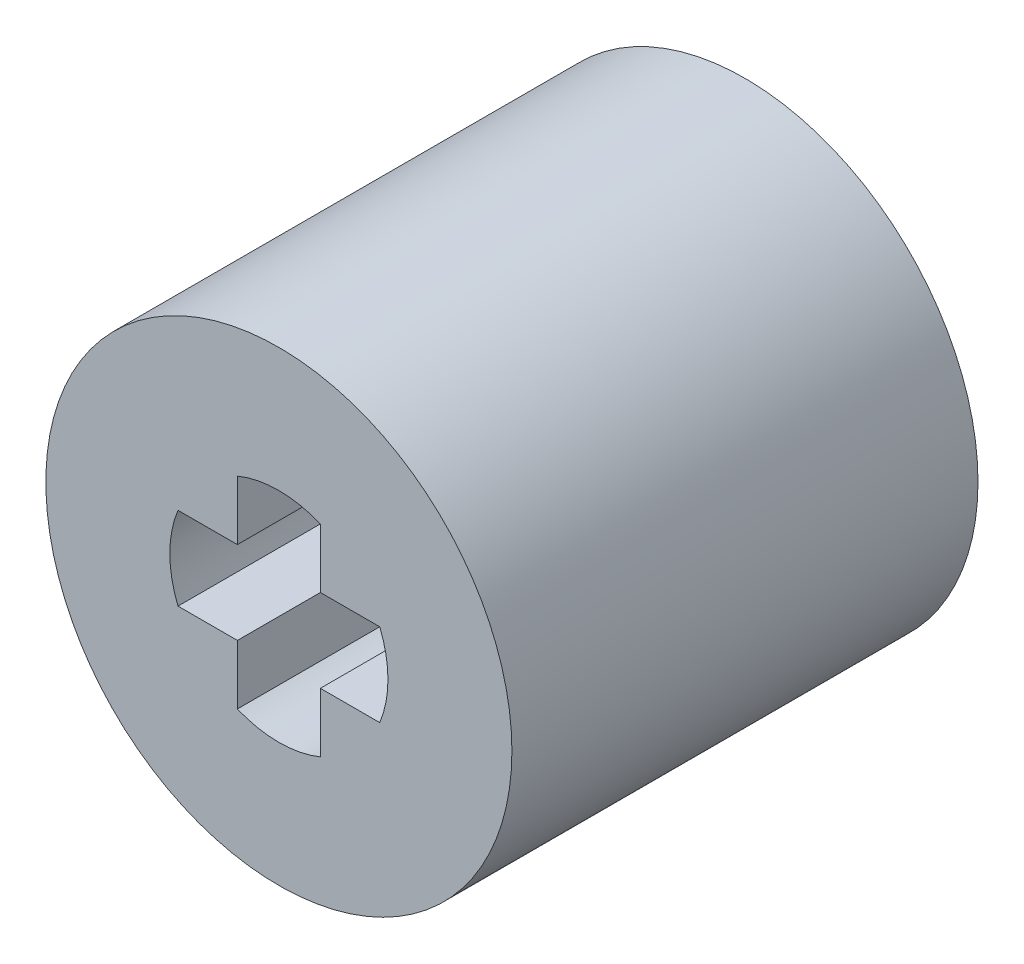
from build123d import *

# Parameters (mm, degrees)
SKETCH1_R           = 5
BOSS_EXTRUDE1_DEPTH = 5
BOSS_EXTRUDE2_START = -5
SKETCH1_3_R         = 5
BOSS_EXTRUDE2_DEPTH = 5


with BuildPart() as part:
    # Sketch1 → Boss-Extrude1 (new body)
    with BuildSketch(Plane.XY):
        Circle(SKETCH1_R)
        with BuildLine():
            ThreePointArc((-0.89, 2.164139552), (0, 2.34), (0.89, 2.164139552))
            Line((0.89, 2.164139552), (0.89, 0.89))
            Line((0.89, 0.89), (2.164139552, 0.89))
            ThreePointArc((2.164139552, 0.89), (2.34, 0), (2.164139552, -0.89))
            Line((2.164139552, -0.89), (0.89, -0.89))
            Line((0.89, -0.89), (0.89, -2.164139552))
            ThreePointArc((0.89, -2.164139552), (0, -2.34), (-0.89, -2.164139552))
            Line((-0.89, -2.164139552), (-0.89, -0.89))
            Line((-0.89, -0.89), (-2.164139552, -0.89))
            ThreePointArc((-2.164139552, -0.89), (-2.34, 0), (-2.164139552, 0.89))
            Line((-2.164139552, 0.89), (-0.89, 0.89))
            Line((-0.89, 0.89), (-0.89, 2.164139552))
        make_face(mode=Mode.SUBTRACT)
    extrude(amount=BOSS_EXTRUDE1_DEPTH)

    # Sketch1<3> → Boss-Extrude2 (add)
    with BuildSketch(Plane.XY.offset(BOSS_EXTRUDE2_START)):
        Circle(SKETCH1_3_R)
        with BuildLine():
            ThreePointArc((1.118033989, 1), (0, -1.5), (-1.118033989, 1))
            Line((-1.118033989, 1), (1.118033989, 1))
        make_face(mode=Mode.SUBTRACT)
    extrude(amount=BOSS_EXTRUDE2_DEPTH)


solid = part.part
